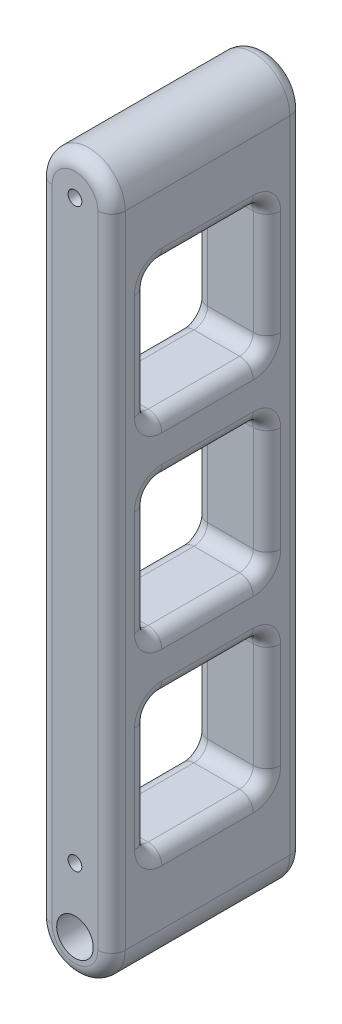
from build123d import *

# Parameters (mm, degrees)
SKETCH1_R               = 4
SKETCH1_R_2             = 1.5
BOSS_EXTRUDE1_DEPTH     = 42
CUT_EXTRUDE4_DEPTH      = 155.673850408
CUT_EXTRUDE4_DEPTH_BACK = 155.673850408
SKETCH6_W               = 26
SKETCH6_H               = 29
SKETCH5_R               = 1.5
CUT_EXTRUDE3_DEPTH      = 6
FILLET5_R               = 3


with BuildPart() as part:
    # Sketch1 → Boss-Extrude1 (new body)
    with BuildSketch(Plane.XY):
        with BuildLine():
            Line((8, 0), (8, 140))
            ThreePointArc((8, 140), (0, 148), (-8, 140))
            Line((-8, 140), (-8, 1.788e-06))
            ThreePointArc((-8, 1.788e-06), (-8.94e-07, -8), (8, 0))
        make_face()
        with Locations(Location((0, 0, 0), (0, 0, 180))):
            Circle(SKETCH1_R, mode=Mode.SUBTRACT)
        with Locations(Location((0, 140, 0), (0, 0, 180))):
            Circle(SKETCH1_R_2, mode=Mode.SUBTRACT)
    extrude(amount=BOSS_EXTRUDE1_DEPTH)

    # Sketch6 → Cut-Extrude4 (cut, two sides: drawn at the far end of the back side and taken through both)
    with BuildSketch(Plane.ZY.offset(8).offset(-CUT_EXTRUDE4_DEPTH_BACK)):
        with Locations((21, 111.5)):
            Rectangle(SKETCH6_W, SKETCH6_H)
        with Locations((21, 70.5)):
            Rectangle(SKETCH6_W, SKETCH6_H)
        with Locations((21, 29.5)):
            Rectangle(SKETCH6_W, SKETCH6_H)
    extrude(amount=CUT_EXTRUDE4_DEPTH + CUT_EXTRUDE4_DEPTH_BACK, mode=Mode.SUBTRACT)

    # Sketch5 → Cut-Extrude3 (cut)
    with BuildSketch(Plane.XY.offset(42)):
        with Locations((0, 14)):
            Circle(SKETCH5_R)
    extrude(amount=-CUT_EXTRUDE3_DEPTH, mode=Mode.SUBTRACT)

    # Fillet5
    fillet5_edges = [part.edges().sort_by_distance(p)[0] for p in [
        (-8.94e-07, -8, 42),
        (8, 70, 42),
        (0, 97, 8),
        (-8, 111.5, 8),
        (8, 111.5, 8),
        (0, 126, 8),
        (-8, 126, 21),
        (8, 126, 21),
        (0, 126, 34),
        (-8, 111.5, 34),
        (8, 111.5, 34),
        (0, 97, 34),
        (-8, 97, 21),
        (8, 97, 21),
        (0, 148, 42),
        (0, 85, 34),
        (-8, 70.5, 34),
        (8, 70.5, 34),
        (0, 56, 34),
        (-8, 56, 21),
        (8, 56, 21),
        (0, 56, 8),
        (-8, 70.5, 8),
        (8, 70.5, 8),
        (0, 85, 8),
        (-8, 85, 21),
        (8, 85, 21),
        (8, 70, 0),
        (-8.94e-07, -8, 0),
        (0, 15, 8),
        (-8, 29.5, 8),
        (8, 29.5, 8),
        (0, 44, 8),
        (-8, 44, 21),
        (8, 44, 21),
        (0, 44, 34),
        (-8, 29.5, 34),
        (8, 29.5, 34),
        (0, 15, 34),
        (-8, 15, 21),
        (8, 15, 21),
        (-8, 70.000000894, 0),
        (0, 148, 0),
        (-8, 70.000000894, 42),
    ]]
    fillet(fillet5_edges, radius=FILLET5_R)


solid = part.part
